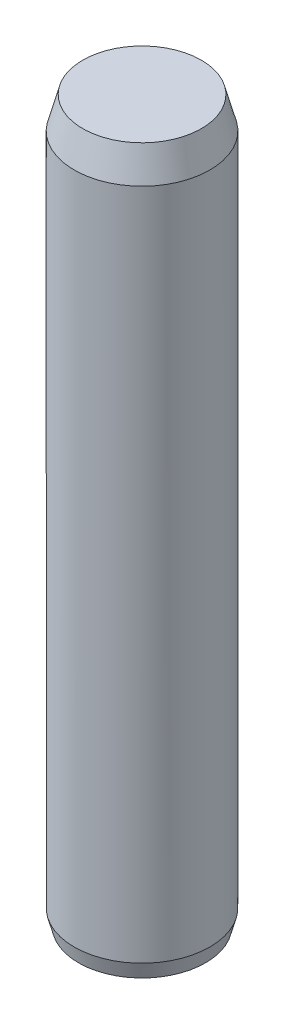
from build123d import *

# Parameters (mm, degrees)
SKETCH1_R           = 16
BOSS_EXTRUDE1_DEPTH = 170
CHAMFER1_SIZE       = 2
CHAMFER1_SIZE2      = 7.464101615
CHAMFER2_SIZE       = 1
CHAMFER2_SIZE2      = 3.732050808


with BuildPart() as part:
    # Sketch1 → Boss-Extrude1 (new body)
    with BuildSketch(Plane(origin=(0, 0, 0), x_dir=(1, 0, 0), z_dir=(0, 1, 0))):
        with Locations(Location((0, 0, 0), (0, 0, 270))):
            Circle(SKETCH1_R)
    extrude(amount=BOSS_EXTRUDE1_DEPTH)

    # Chamfer1
    chamfer1_edges = [part.edges().sort_by_distance(p)[0] for p in [
        (0, 170, -16),
    ]]
    chamfer1_side = [part.faces().sort_by_distance(p)[0] for p in [
        (0, 170, 0),
    ]]
    chamfer(chamfer1_edges, length=CHAMFER1_SIZE, length2=CHAMFER1_SIZE2, reference=chamfer1_side[0])

    # Chamfer2
    chamfer2_edges = [part.edges().sort_by_distance(p)[0] for p in [
        (0, 0, -16),
    ]]
    chamfer2_side = [part.faces().sort_by_distance(p)[0] for p in [
        (0, 0, 0),
    ]]
    chamfer(chamfer2_edges, length=CHAMFER2_SIZE, length2=CHAMFER2_SIZE2, reference=chamfer2_side[0])


solid = part.part
